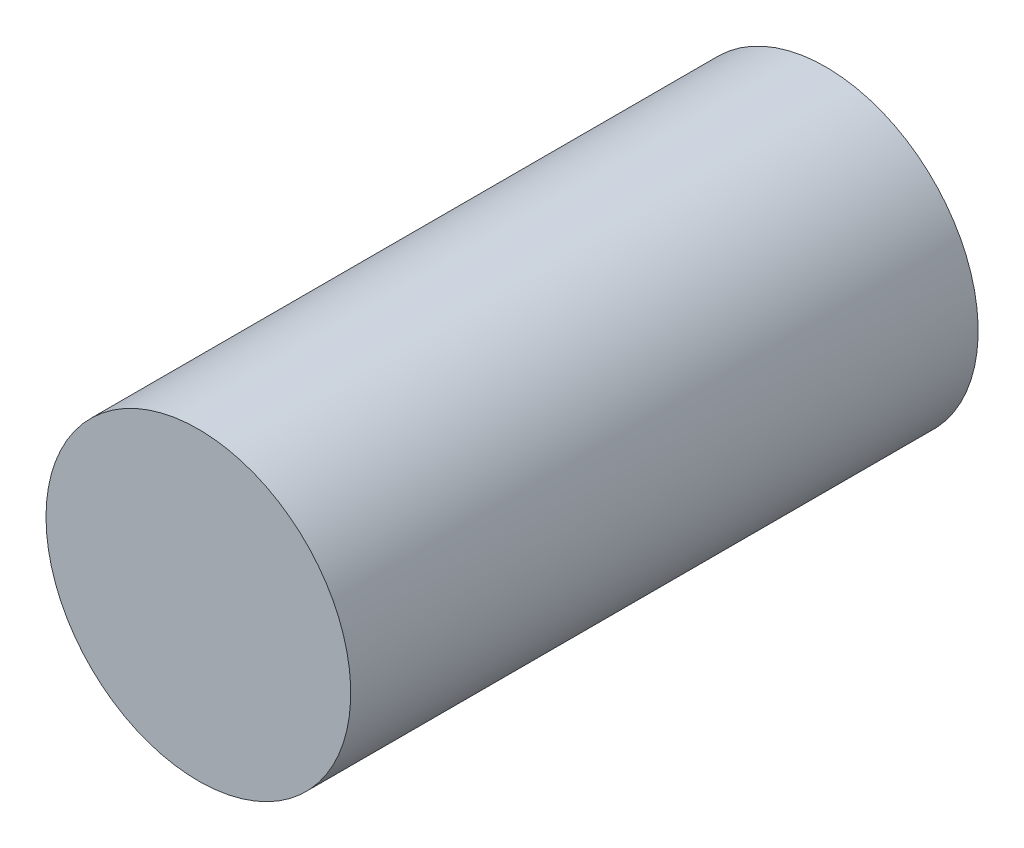
from build123d import *

# Parameters (mm, degrees)
SKETCH1_R           = 1.7
BOSS_EXTRUDE1_DEPTH = 7


with BuildPart() as part:
    # Sketch1 → Boss-Extrude1 (new body)
    with BuildSketch(Plane.XY):
        with Locations(Location((0, 0, 0), (0, 0, 180))):
            Circle(SKETCH1_R)
    extrude(amount=BOSS_EXTRUDE1_DEPTH)


solid = part.part
